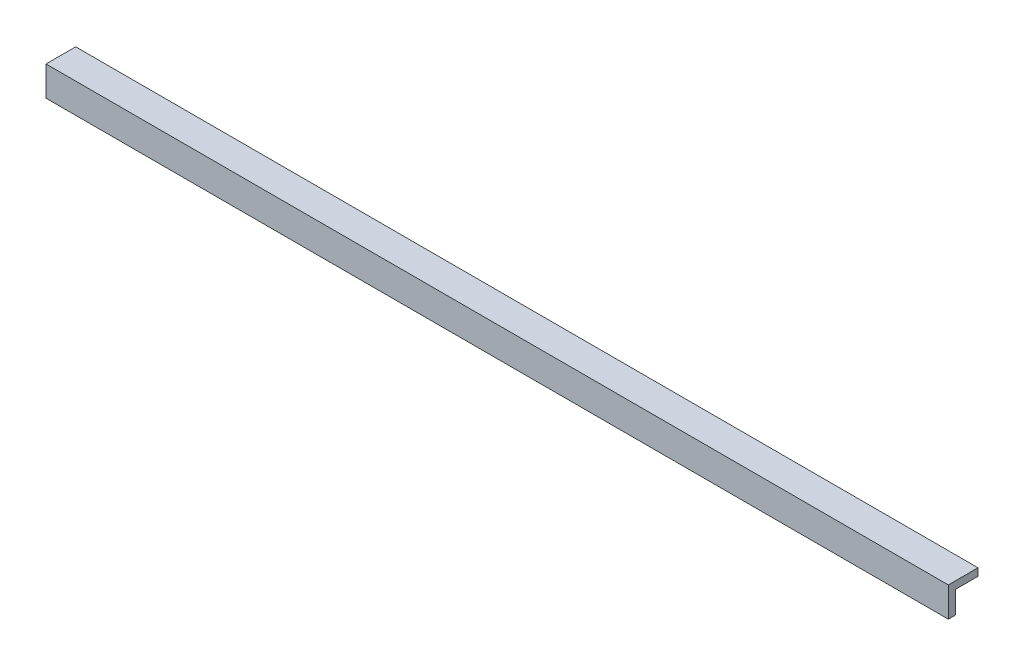
from build123d import *

# Parameters (mm, degrees)
BOSS_EXTRUDE1_DEPTH = 193.04


with BuildPart() as part:
    # Sketch1 → Boss-Extrude1 (new body)
    with BuildSketch(Plane(origin=(0, 0, 0), x_dir=(0, 0, -1), z_dir=(1, 0, 0))):
        Polygon((0, 0), (0, 6.35), (6.35, 6.35), (6.35, 4.7625), (1.5875, 4.7625), (1.5875, 0), align=None)
    extrude(amount=BOSS_EXTRUDE1_DEPTH)


solid = part.part
